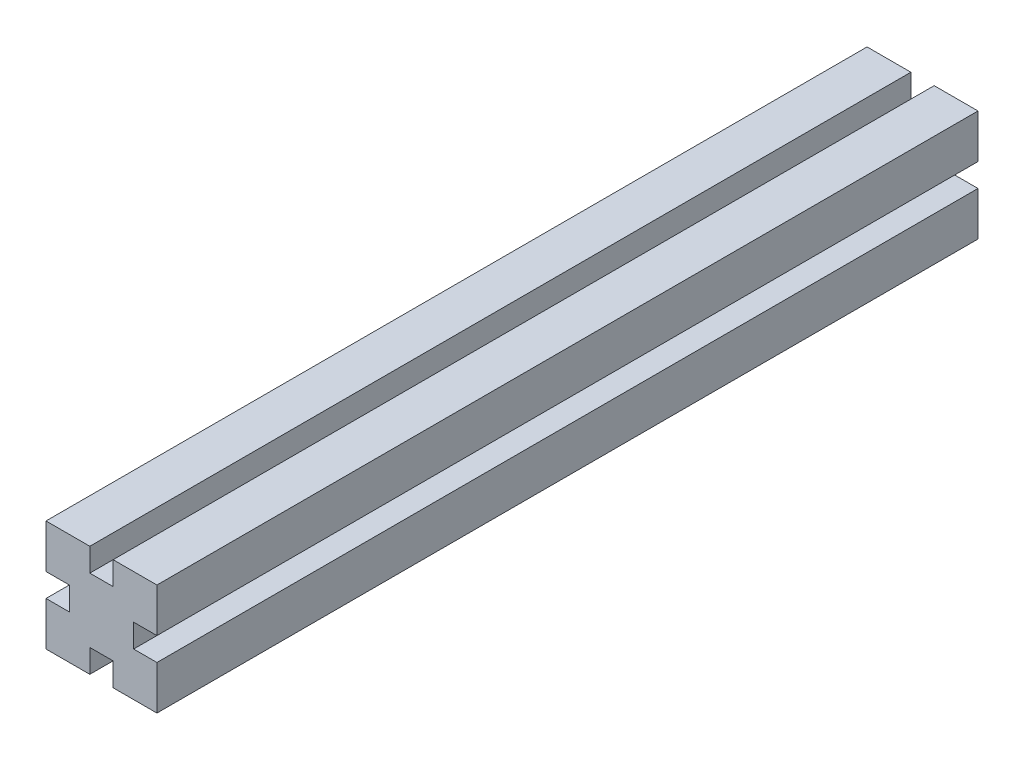
from build123d import *

# Parameters (mm, degrees)
PROFILE_DEPTH = 282


with BuildPart() as part:
    # Sketch1 → Profile (new body)
    with BuildSketch(Plane.XY):
        Polygon((-19.05, -19.05), (-4, -19.05), (-4, -11.05), (4, -11.05), (4, -19.05), (19.05, -19.05), (19.05, -4), (11.05, -4), (11.05, 4), (19.05, 4), (19.05, 19.05), (4, 19.05), (4, 11.05), (-4, 11.05), (-4, 19.05), (-19.05, 19.05), (-19.05, 4), (-11.05, 4), (-11.05, -4), (-19.05, -4), align=None)
    extrude(amount=PROFILE_DEPTH)


solid = part.part
